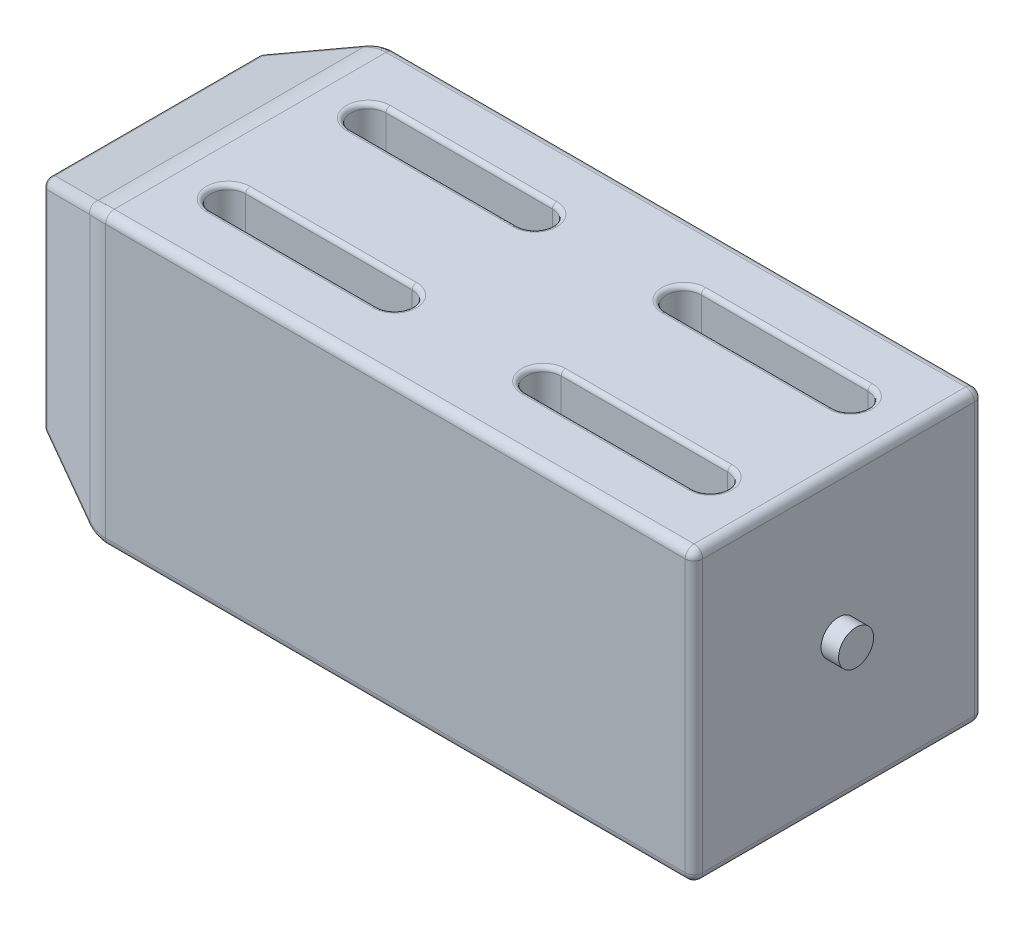
from build123d import *

# Parameters (mm, degrees)
SKETCH1_W                = 78.2
SKETCH1_H                = 33
BOSS_EXTRUDE1_DEPTH      = 16.5
SKETCH3_OUTSIDE_W        = 65.334
SKETCH3_OUTSIDE_H        = 65.334
SKETCH3_OUTSIDE_W_2      = 25
SKETCH3_OUTSIDE_H_2      = 25
CUT_EXTRUDE1_DEPTH       = 15
CUT_EXTRUDE1_DRAFT       = -22
CUT_EXTRUDE2_DEPTH       = 54.759278269
BOSS_EXTRUDE2_DEPTH      = 2
BOSS_EXTRUDE2_DEPTH_BACK = 81.2
SKETCH2_R                = 2
FILLET2_R                = 6
FILLET3_R                = 1
FILLET4_R                = 0.5


with BuildPart() as part:
    # Sketch1 → Boss-Extrude1 (new, symmetric)
    with BuildSketch(Plane.XY):
        Rectangle(SKETCH1_W, SKETCH1_H)
    extrude(amount=BOSS_EXTRUDE1_DEPTH, both=True)


with BuildPart() as cut_extrude1_tool:
    # Sketch3 outside → Cut-Extrude1 (with draft: the straight prism first)
    with BuildSketch(Plane.ZY.offset(39.1)):
        Rectangle(SKETCH3_OUTSIDE_W, SKETCH3_OUTSIDE_H)
        Rectangle(SKETCH3_OUTSIDE_W_2, SKETCH3_OUTSIDE_H_2, mode=Mode.SUBTRACT)
    extrude(amount=-CUT_EXTRUDE1_DEPTH)
    # Cut-Extrude1: the draft: its side faces are tilted about the plane it starts from
    cut_extrude1_sides = [cut_extrude1_tool.faces().sort_by_distance(p)[0] for p in [
        (-31.6, -32.667, 0),
        (-31.6, 0, 32.667),
        (-31.6, 32.667, 0),
        (-31.6, 0, -32.667),
        (-31.6, -12.5, 0),
        (-31.6, 0, -12.5),
        (-31.6, 12.5, 0),
        (-31.6, 0, 12.5),
    ]]
    draft(cut_extrude1_sides, Plane.ZY.offset(39.1), CUT_EXTRUDE1_DRAFT)


with BuildPart() as part_1:
    add(part.part)

    # Cut-Extrude1: cut by cut_extrude1_tool
    add(cut_extrude1_tool.part, mode=Mode.SUBTRACT)

    # Sketch4 → Cut-Extrude2 (cut, through all)
    with BuildSketch(Plane(origin=(0, 16.5, 0), x_dir=(1, 0, 0), z_dir=(0, 1, 0))):
        with BuildLine():
            Line((-22.549826293, 10), (-3.549826293, 10))
            ThreePointArc((-3.549826293, 10), (-1.549826293, 8), (-3.549826293, 6))
            Line((-3.549826293, 6), (-22.549826293, 6))
            ThreePointArc((-22.549826293, 6), (-24.549826293, 8), (-22.549826293, 10))
        make_face()
        with BuildLine():
            Line((32.450173707, 10), (13.450173707, 10))
            ThreePointArc((13.450173707, 10), (11.450173707, 8), (13.450173707, 6))
            Line((13.450173707, 6), (32.450173707, 6))
            ThreePointArc((32.450173707, 6), (34.450173707, 8), (32.450173707, 10))
        make_face()
    cut_extrude2 = extrude(amount=-CUT_EXTRUDE2_DEPTH, mode=Mode.SUBTRACT)

    # Sketch2 → Boss-Extrude2 (add, two sides: drawn at the far end of the back side and taken through both)
    with BuildSketch(Plane(origin=(39.1, 0, 0), x_dir=(0, 0, -1), z_dir=(1, 0, 0)).offset(-BOSS_EXTRUDE2_DEPTH_BACK)):
        Circle(SKETCH2_R)
    extrude(amount=BOSS_EXTRUDE2_DEPTH + BOSS_EXTRUDE2_DEPTH_BACK)

    # Mirror1: Cut-Extrude2 across plane
    add(cut_extrude2.mirror(Plane.XY), mode=Mode.SUBTRACT)

    # Fillet2
    fillet2_edges = [part_1.edges().sort_by_distance(p)[0] for p in [
        (-29.199652586, 0, -16.5),
        (-29.199652586, 0, 16.5),
        (-29.199652586, -16.5, 0),
        (-29.199652586, 16.5, 0),
    ]]
    fillet(fillet2_edges, radius=FILLET2_R)

    # Fillet3
    fillet3_edges = [part_1.edges().sort_by_distance(p)[0] for p in [
        (39.1, 0, 16.5),
        (-34.690505146, 14.281551564, 14.281551564),
        (-34.690505146, -14.281551564, 14.281551564),
        (5.533314634, -16.5, 16.5),
        (-34.690505146, 14.281551564, -14.281551564),
        (5.533314634, -16.5, -16.5),
        (-34.690505146, -14.281551564, -14.281551564),
        (-29.197439664, -16.385995542, -16.385995542),
        (-29.197439664, 16.385995542, -16.385995542),
        (-29.197439664, -16.385995542, 16.385995542),
        (-29.197439664, 16.385995542, 16.385995542),
        (5.533314634, 16.5, 16.5),
        (-39.1, 0, 12.5),
        (-39.1, -12.5, 0),
        (-39.1, 12.5, 0),
        (-39.1, 0, -12.5),
        (5.533314634, 16.5, -16.5),
        (39.1, 0, -16.5),
        (39.1, 16.5, 0),
        (39.1, -16.5, 0),
    ]]
    fillet(fillet3_edges, radius=FILLET3_R)

    # Fillet4
    fillet4_edges = [part_1.edges().sort_by_distance(p)[0] for p in [
        (22.950173707, -16.5, 6),
        (-24.549826293, -16.5, -8),
        (-13.049826293, -16.5, -10),
        (-1.549826293, -16.5, -8),
        (-13.049826293, -16.5, -6),
        (-24.549826293, 16.5, -8),
        (-13.049826293, 16.5, -6),
        (-1.549826293, 16.5, -8),
        (-13.049826293, 16.5, -10),
        (34.450173707, -16.5, -8),
        (22.950173707, -16.5, -6),
        (11.450173707, -16.5, -8),
        (22.950173707, -16.5, -10),
        (34.450173707, 16.5, -8),
        (22.950173707, 16.5, -10),
        (11.450173707, 16.5, -8),
        (22.950173707, 16.5, -6),
        (-24.549826293, 16.5, 8),
        (-13.049826293, 16.5, 6),
        (-1.549826293, 16.5, 8),
        (-13.049826293, 16.5, 10),
        (-24.549826293, -16.5, 8),
        (-13.049826293, -16.5, 6),
        (-1.549826293, -16.5, 8),
        (-13.049826293, -16.5, 10),
        (34.450173707, 16.5, 8),
        (22.950173707, 16.5, 10),
        (11.450173707, 16.5, 8),
        (22.950173707, 16.5, 6),
        (34.450173707, -16.5, 8),
        (22.950173707, -16.5, 10),
        (11.450173707, -16.5, 8),
    ]]
    fillet(fillet4_edges, radius=FILLET4_R)


solid = part_1.part
